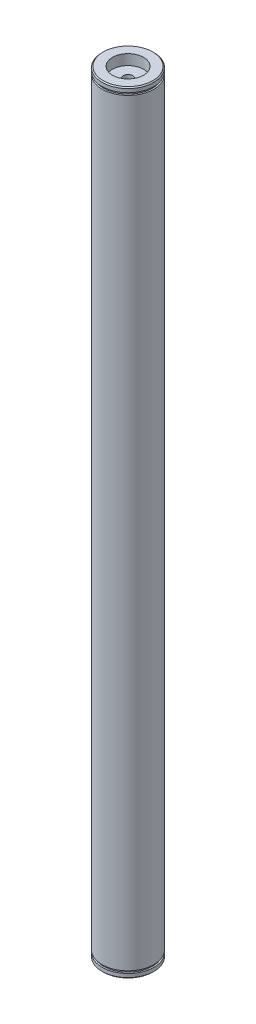
from build123d import *

# Parameters (mm, degrees)
SKETCH_1_R                = 25
EXTRUDE_1_DEPTH           = 373
SKETCH_2_R                = 15
CUT_EXTRUDE_1_DEPTH       = 10
HOLE_WIZARD_8_0_8_1_D     = 8
HOLE_WIZARD_8_0_8_1_DEPTH = 119
HOLE_WIZARD_8_0_8_1_TIP   = 2.403442476
SKETCH_5_R                = 3
CUT_EXTRUDE_2_DEPTH       = 100
M10X1_0_1_D               = 9
M10X1_0_1_DEPTH           = 25
M10X1_0_1_TIP             = 2.703872786
CUT_EXTRUDE_START         = -10
SKETCH_8_R                = 15
CUT_EXTRUDE_3_DEPTH       = 10
HOLE_WIZARD_8_0_8_2_D     = 8
HOLE_WIZARD_8_0_8_2_DEPTH = 119
HOLE_WIZARD_8_0_8_2_TIP   = 2.403442476
M10X1_0_2_D               = 9
M10X1_0_2_DEPTH           = 25
M10X1_0_2_TIP             = 2.703872786
SKETCH_12_R               = 3
CUT_EXTRUDE_4_DEPTH       = 51
CHAMFER_1_SIZE            = 1
SKETCH_14_W               = 1.5
SKETCH_14_H               = 2.2


with BuildPart() as part:
    # 草图1 → 凸台-拉伸1 (new, symmetric)
    with BuildSketch(Plane(origin=(0, 0, 0), x_dir=(1, 0, 0), z_dir=(0, 1, 0))):
        with Locations(Location((0, 0, 0), (0, 0, 270))):
            Circle(SKETCH_1_R)
    extrude(amount=EXTRUDE_1_DEPTH, both=True)

    # 草图2 → 切除-拉伸1 (cut)
    with BuildSketch(Plane(origin=(0, 373, 0), x_dir=(1, 0, 0), z_dir=(0, 1, 0))):
        with Locations(Location((0, 0, 0), (0, 0, 270))):
            Circle(SKETCH_2_R)
    extrude(amount=-CUT_EXTRUDE_1_DEPTH, mode=Mode.SUBTRACT)

    # Ø8.0 (8) 直径孔1
    with Locations(Plane.ZX.offset(363)):
        with Locations((0, 0)):
            Hole(HOLE_WIZARD_8_0_8_1_D / 2, depth=HOLE_WIZARD_8_0_8_1_DEPTH)
            with Locations((0, 0, -(HOLE_WIZARD_8_0_8_1_DEPTH + HOLE_WIZARD_8_0_8_1_TIP / 2))):  # 118° drill point
                Cone(0, HOLE_WIZARD_8_0_8_1_D / 2, HOLE_WIZARD_8_0_8_1_TIP, mode=Mode.SUBTRACT)

    # 草图5 → 切除-拉伸2 (cut)
    with BuildSketch(Plane.XY):
        with Locations((0, 248)):
            Circle(SKETCH_5_R)
    extrude(amount=-CUT_EXTRUDE_2_DEPTH, mode=Mode.SUBTRACT)

    # M10x1.0 螺纹孔1
    with Locations(Plane(origin=(0, 363, 0), x_dir=(1, 0, 0), z_dir=(0, 1, 0))):
        with Locations((0, 0)):
            Hole(M10X1_0_1_D / 2, depth=M10X1_0_1_DEPTH)
            with Locations((0, 0, -(M10X1_0_1_DEPTH + M10X1_0_1_TIP / 2))):  # 118° drill point
                Cone(0, M10X1_0_1_D / 2, M10X1_0_1_TIP, mode=Mode.SUBTRACT)

    # 草图8 → 切除-拉伸3 (cut)
    with BuildSketch(Plane.XZ.offset(373).offset(CUT_EXTRUDE_START)):
        with Locations(Location((0, 0, 0), (0, 0, 90))):
            Circle(SKETCH_8_R)
    extrude(amount=CUT_EXTRUDE_3_DEPTH, mode=Mode.SUBTRACT)

    # Ø8.0 (8) 直径孔2
    with Locations(Plane(origin=(0, -363, 0), x_dir=(0, 0, -1), z_dir=(0, -1, 0))):
        with Locations((0, 0)):
            Hole(HOLE_WIZARD_8_0_8_2_D / 2, depth=HOLE_WIZARD_8_0_8_2_DEPTH)
            with Locations((0, 0, -(HOLE_WIZARD_8_0_8_2_DEPTH + HOLE_WIZARD_8_0_8_2_TIP / 2))):  # 118° drill point
                Cone(0, HOLE_WIZARD_8_0_8_2_D / 2, HOLE_WIZARD_8_0_8_2_TIP, mode=Mode.SUBTRACT)

    # M10x1.0 螺纹孔2
    with Locations(Plane(origin=(0, -363, 0), x_dir=(-1, 0, 0), z_dir=(0, -1, 0))):
        with Locations((0, 0)):
            Hole(M10X1_0_2_D / 2, depth=M10X1_0_2_DEPTH)
            with Locations((0, 0, -(M10X1_0_2_DEPTH + M10X1_0_2_TIP / 2))):  # 118° drill point
                Cone(0, M10X1_0_2_D / 2, M10X1_0_2_TIP, mode=Mode.SUBTRACT)

    # 草图12 → 切除-拉伸4 (cut)
    with BuildSketch(Plane.XY):
        with Locations(Location((0, -248, 0), (0, 0, 90))):
            Circle(SKETCH_12_R)
    extrude(amount=-CUT_EXTRUDE_4_DEPTH, mode=Mode.SUBTRACT)

    # 倒角1
    chamfer_1_edges = [part.edges().sort_by_distance(p)[0] for p in [
        (0, -373, -25),
        (0, 373, -25),
    ]]
    chamfer(chamfer_1_edges, length=CHAMFER_1_SIZE)

    # 草图14 → 切除-旋转1 (revolve, cut)
    with BuildSketch(Plane(origin=(0, 0, 0), x_dir=(0, 0, -1), z_dir=(1, 0, 0))):
        with Locations((24.25, 367.4)):
            Rectangle(SKETCH_14_W, SKETCH_14_H)
        with Locations((24.25, -367.4)):
            Rectangle(SKETCH_14_W, SKETCH_14_H)
    revolve(axis=Axis((0, 0, 0), (0, 1, 0)), mode=Mode.SUBTRACT)


solid = part.part
